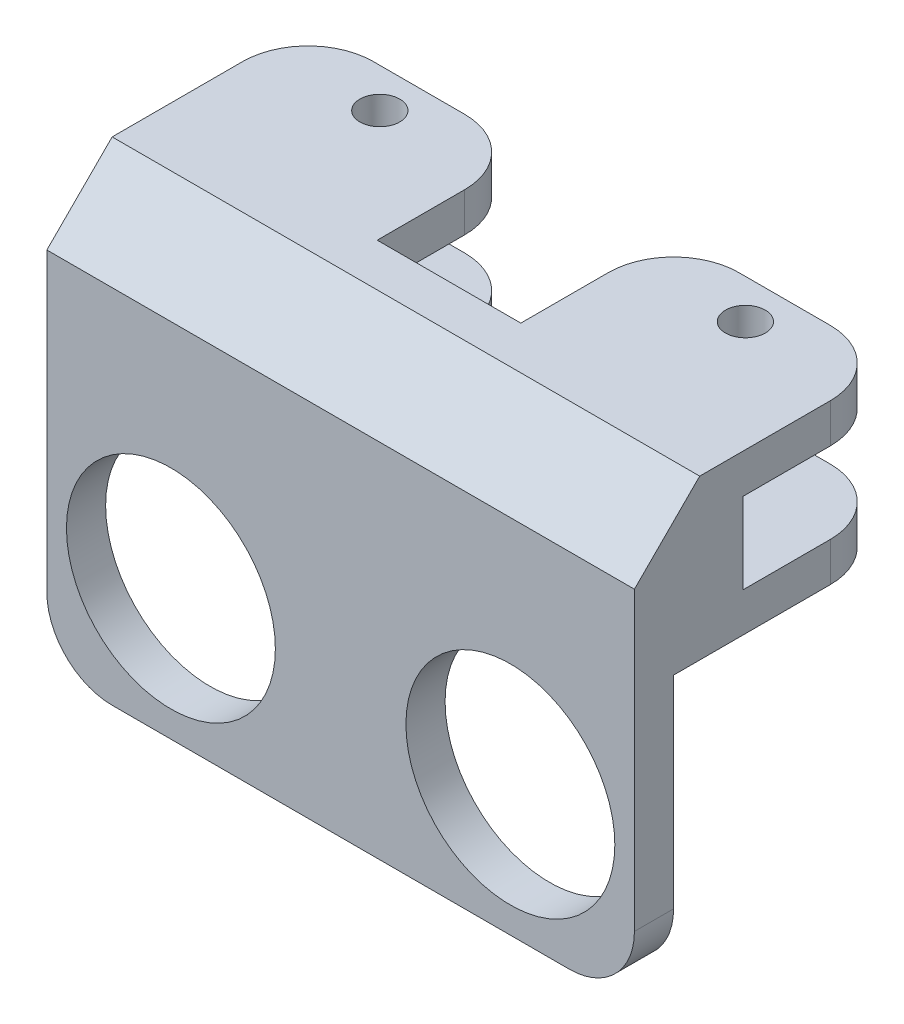
from build123d import *

# Parameters (mm, degrees)
SKETCH1_R           = 8
BOSS_EXTRUDE1_DEPTH = 3
SKETCH2_W           = 17
SKETCH2_H           = 3
BOSS_EXTRUDE2_DEPTH = 17
SKETCH3_W           = 45
SKETCH3_H           = 3
BOSS_EXTRUDE3_DEPTH = 9.2
BOSS_EXTRUDE4_REACH = 41.571
SKETCH4_W           = 5.3
SKETCH4_H           = 3
SKETCH6_W           = 45
SKETCH6_H           = 5.3
BOSS_EXTRUDE5_DEPTH = 9.2
SKETCH7_W           = 17
SKETCH7_H           = 3
BOSS_EXTRUDE6_DEPTH = 11.7
SKETCH8_R           = 1.525
CUT_EXTRUDE1_DEPTH  = 44.180319591
CHAMFER1_SIZE       = 5
FILLET1_R           = 5


with BuildPart() as part:
    # Sketch1 → Boss-Extrude1 (new body)
    with BuildSketch(Plane.XY):
        with BuildLine():
            Line((-17.5, -10.5), (17.5, -10.5))
            ThreePointArc((17.5, -10.5), (21.035533906, -9.035533906), (22.5, -5.5))
            Line((22.5, -5.5), (22.5, 10.5))
            Line((22.5, 10.5), (22.5, 13))
            Line((22.5, 13), (-22.5, 13))
            Line((-22.5, 13), (-22.5, 10.5))
            Line((-22.5, 10.5), (-22.5, -5.5))
            ThreePointArc((-22.5, -5.5), (-21.035533906, -9.035533906), (-17.5, -10.5))
        make_face()
        with Locations((13, -0.5)):
            Circle(SKETCH1_R, mode=Mode.SUBTRACT)
        with Locations((-13, -0.5)):
            Circle(SKETCH1_R, mode=Mode.SUBTRACT)
    extrude(amount=BOSS_EXTRUDE1_DEPTH)

    # Sketch2 → Boss-Extrude2 (add)
    with BuildSketch(Plane(origin=(0, 0, 0), x_dir=(-1, 0, 0), z_dir=(0, 0, -1))):
        with Locations((-14, 11.5)):
            Rectangle(SKETCH2_W, SKETCH2_H)
        with Locations((14, 11.5)):
            Rectangle(SKETCH2_W, SKETCH2_H)
    extrude(amount=BOSS_EXTRUDE2_DEPTH)

    # Sketch3 → Boss-Extrude3 (add)
    with BuildSketch(Plane(origin=(0, 13, 0), x_dir=(1, 0, 0), z_dir=(0, 1, 0))):
        with Locations((0, -1.5)):
            Rectangle(SKETCH3_W, SKETCH3_H)
    extrude(amount=BOSS_EXTRUDE3_DEPTH)

    # Sketch4 → Boss-Extrude4 (add, up to next)
    with BuildSketch(Plane(origin=(-5.5, 0, 0), x_dir=(0, 0, -1), z_dir=(1, 0, 0)), mode=Mode.PRIVATE) as boss_extrude4_sk1:
        with Locations((2.65, 11.5)):
            Rectangle(SKETCH4_W, SKETCH4_H)
    boss_extrude4_tool1 = extrude(boss_extrude4_sk1.sketch, amount=BOSS_EXTRUDE4_REACH, mode=Mode.PRIVATE) - part.part
    add(boss_extrude4_tool1.solids().sort_by_distance((-5.5, 11.5, -2.65))[0])

    # Sketch6 → Boss-Extrude5 (add)
    with BuildSketch(Plane(origin=(0, 13, 0), x_dir=(1, 0, 0), z_dir=(0, 1, 0))):
        with Locations((0, 2.65)):
            Rectangle(SKETCH6_W, SKETCH6_H)
    extrude(amount=BOSS_EXTRUDE5_DEPTH)

    # Sketch7 → Boss-Extrude6 (add, through all)
    with BuildSketch(Plane(origin=(0, 0, -5.3), x_dir=(-1, 0, 0), z_dir=(0, 0, -1))):
        with Locations((-14, 20.7)):
            Rectangle(SKETCH7_W, SKETCH7_H)
        with Locations((14, 20.7)):
            Rectangle(SKETCH7_W, SKETCH7_H)
    extrude(amount=BOSS_EXTRUDE6_DEPTH)

    # Sketch8 → Cut-Extrude1 (cut, through all)
    with BuildSketch(Plane(origin=(0, 22.2, 0), x_dir=(1, 0, 0), z_dir=(0, 1, 0))):
        with Locations(Location((14, 14, 0), (0, 0, 270))):
            Circle(SKETCH8_R)
        with Locations(Location((-14, 14, 0), (0, 0, 270))):
            Circle(SKETCH8_R)
    extrude(amount=-CUT_EXTRUDE1_DEPTH, mode=Mode.SUBTRACT)

    # Chamfer1
    chamfer1_edges = [part.edges().sort_by_distance(p)[0] for p in [
        (0, 22.2, 3),
    ]]
    chamfer(chamfer1_edges, length=CHAMFER1_SIZE)

    # Fillet1
    fillet1_edges = [part.edges().sort_by_distance(p)[0] for p in [
        (22.5, 20.7, -17),
        (5.5, 20.7, -17),
        (-22.5, 20.7, -17),
        (-5.5, 20.7, -17),
        (5.5, 11.5, -17),
        (22.5, 11.5, -17),
        (-5.5, 11.5, -17),
        (-22.5, 11.5, -17),
    ]]
    fillet(fillet1_edges, radius=FILLET1_R)


solid = part.part
